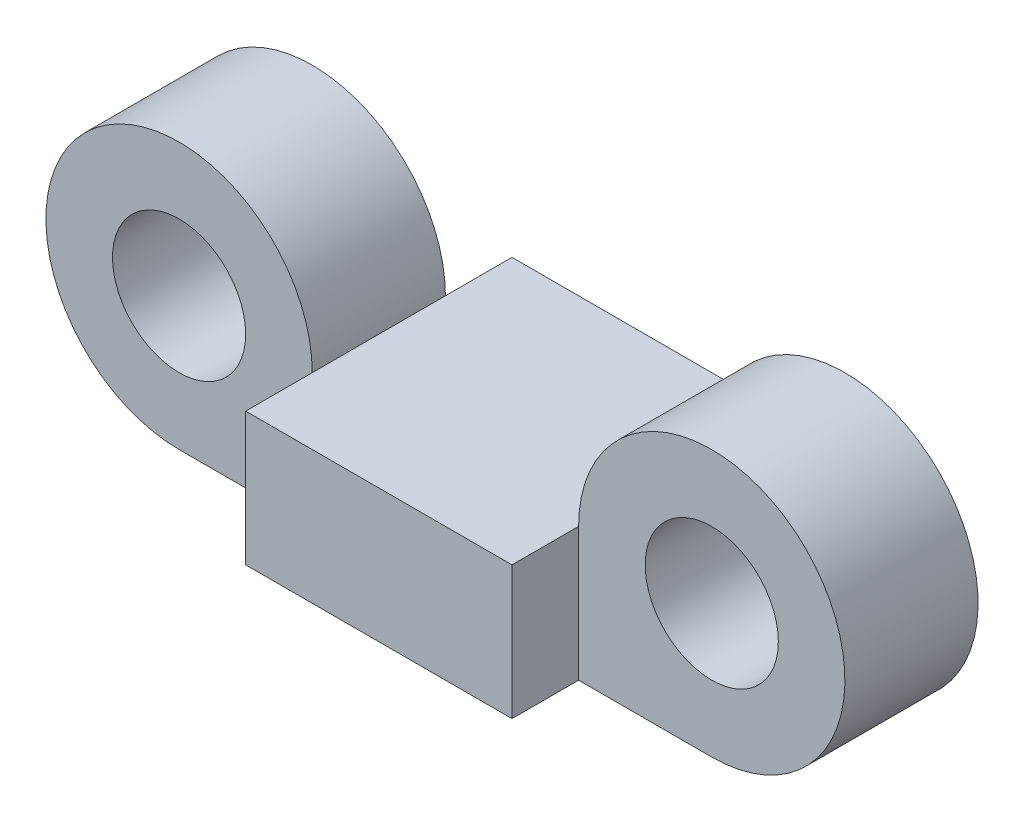
from build123d import *

# Parameters (mm, degrees)
SKETCH1_R           = 2.5
BOSS_EXTRUDE1_DEPTH = 5
SKETCH2_W           = 10
SKETCH2_H           = 10
BOSS_EXTRUDE2_DEPTH = 5


with BuildPart() as part:
    # Sketch1 → Boss-Extrude1 (new body)
    with BuildSketch(Plane.XY):
        with BuildLine():
            ThreePointArc((5, 0), (-3.535533906, 3.535533906), (0, -5))
            Line((0, -5), (20, -5))
            ThreePointArc((20, -5), (23.535533906, 3.535533906), (15, 0))
            Line((15, 0), (5, 0))
        make_face()
        with Locations((20, 0)):
            Circle(SKETCH1_R, mode=Mode.SUBTRACT)
        Circle(SKETCH1_R, mode=Mode.SUBTRACT)
    extrude(amount=BOSS_EXTRUDE1_DEPTH)

    # Sketch2 → Boss-Extrude2 (add)
    with BuildSketch(Plane(origin=(0, 0, 0), x_dir=(1, 0, 0), z_dir=(0, 1, 0))):
        with Locations((10, -2.5)):
            Rectangle(SKETCH2_W, SKETCH2_H)
    extrude(amount=-BOSS_EXTRUDE2_DEPTH)


solid = part.part
